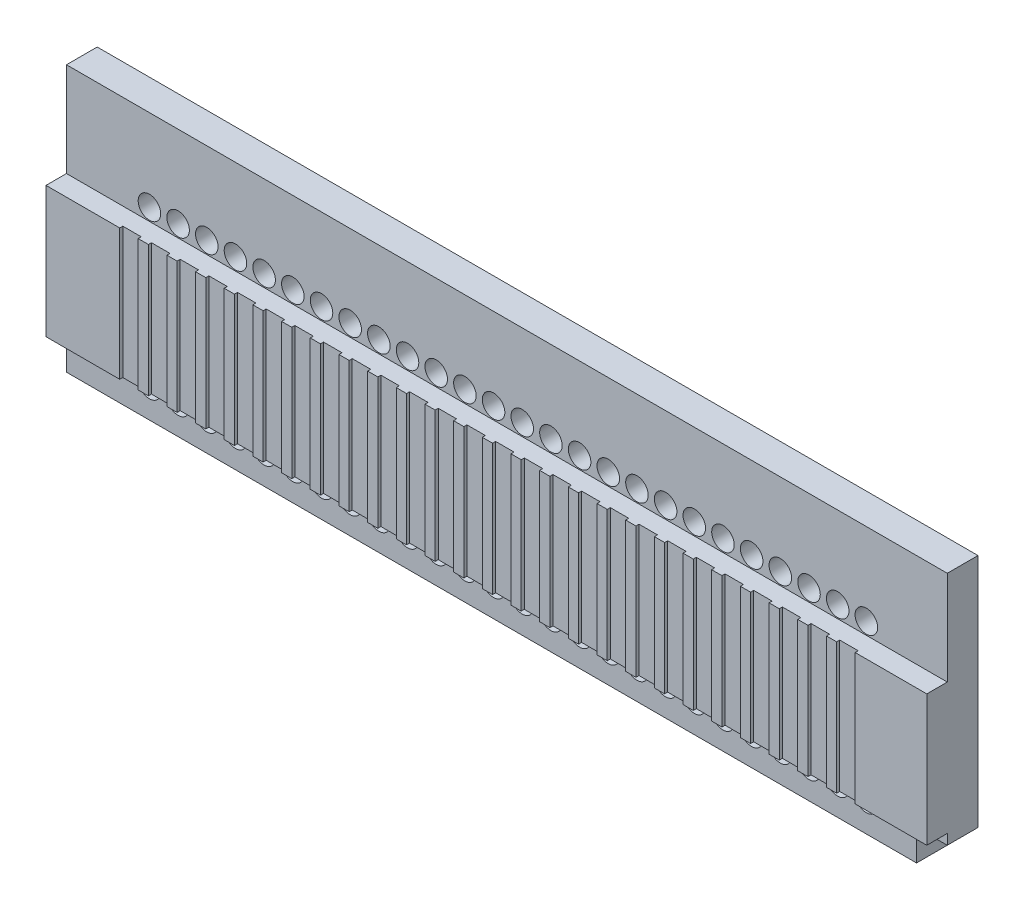
from build123d import *

# Parameters (mm, degrees)
ESQUISSE1_W                = 43
ESQUISSE1_H                = 13
BOSS_EXTRU_1_DEPTH         = 1.5
ESQUISSE2_W                = 1
ESQUISSE2_H                = 6.4
BOSS_EXTRU_2_DEPTH         = 1
ESQUISSE3_W                = 1
ESQUISSE3_H                = 6.4
BOSS_EXTRU_3_DEPTH         = 42
ESQUISSE8_W                = 1.5
ESQUISSE8_H                = 1.5
ENL_V_MAT_EXTRU_5_DEPTH    = 4.5
ESQUISSE9_W                = 0.9
ESQUISSE9_H                = 6.4
ENL_V_MAT_EXTRU_6_DEPTH    = 0.15
R_P_TITION_LIN_AIRE4_COUNT = 26
R_P_TITION_LIN_AIRE4_PITCH = 1.4
ESQUISSE10_R               = 0.55
ENL_V_MAT_EXTRU_8_DEPTH    = 45.947191236
R_P_TITION_LIN_AIRE5_COUNT = 26
R_P_TITION_LIN_AIRE5_PITCH = 1.4
ESQUISSE11_R               = 0.55
ENL_V_MAT_EXTRU_9_DEPTH    = 7.3
R_P_TITION_LIN_AIRE6_COUNT = 26
R_P_TITION_LIN_AIRE6_PITCH = 1.4


with BuildPart() as part:
    # Esquisse1 → Boss.-Extru.1 (new body)
    with BuildSketch(Plane.XY):
        with Locations((21.5, 6.5)):
            Rectangle(ESQUISSE1_W, ESQUISSE1_H)
    extrude(amount=BOSS_EXTRU_1_DEPTH)

    # Esquisse2 → Boss.-Extru.2 (add)
    with BuildSketch(Plane.XY.offset(1.5)):
        with Locations((42.5, 5.2)):
            Rectangle(ESQUISSE2_W, ESQUISSE2_H)
    extrude(amount=BOSS_EXTRU_2_DEPTH)

    # Esquisse3 → Boss.-Extru.3 (add)
    with BuildSketch(Plane.ZY.offset(-42)):
        with Locations((2, 5.2)):
            Rectangle(ESQUISSE3_W, ESQUISSE3_H)
    extrude(amount=BOSS_EXTRU_3_DEPTH)

    # Esquisse8 → Enlèv. mat.-Extru.5 (cut)
    with BuildSketch(Plane(origin=(0, 0, 0), x_dir=(-1, 0, 0), z_dir=(0, 0, -1))):
        with Locations((-42.25, 0.75)):
            Rectangle(ESQUISSE8_W, ESQUISSE8_H)
    extrude(amount=-ENL_V_MAT_EXTRU_5_DEPTH, mode=Mode.SUBTRACT)

    # Esquisse9 → Enlèv. mat.-Extru.6 (cut)
    with BuildSketch(Plane.XY.offset(2.5)):
        with Locations((39.05, 5.2)):
            Rectangle(ESQUISSE9_W, ESQUISSE9_H)
    enl_v_mat_extru_6 = extrude(amount=-ENL_V_MAT_EXTRU_6_DEPTH, mode=Mode.SUBTRACT)

    # Répétition linéaire4: Enlèv. mat.-Extru.6 ×26
    with Locations(*[(-i * R_P_TITION_LIN_AIRE4_PITCH, 0, 0) for i in range(1, R_P_TITION_LIN_AIRE4_COUNT)]):
        add(enl_v_mat_extru_6, mode=Mode.SUBTRACT)

    # Esquisse10 → Enlèv. mat.-Extru.8 (cut, through all)
    with BuildSketch(Plane.XY.offset(1.5)):
        with Locations((39.05, 9)):
            Circle(ESQUISSE10_R)
    enl_v_mat_extru_8 = extrude(amount=-ENL_V_MAT_EXTRU_8_DEPTH, mode=Mode.SUBTRACT)

    # Répétition linéaire5: Enlèv. mat.-Extru.8 ×26
    with Locations(*[(-i * R_P_TITION_LIN_AIRE5_PITCH, 0, 0) for i in range(1, R_P_TITION_LIN_AIRE5_COUNT)]):
        add(enl_v_mat_extru_8, mode=Mode.SUBTRACT)

    # Esquisse11 → Enlèv. mat.-Extru.9 (cut)
    with BuildSketch(Plane.XY.offset(1.5)):
        with Locations(Location((39.05, 1.45, 0), (0, 0, 90))):
            Circle(ESQUISSE11_R)
    enl_v_mat_extru_9 = extrude(amount=-ENL_V_MAT_EXTRU_9_DEPTH, mode=Mode.SUBTRACT)

    # Répétition linéaire6: Enlèv. mat.-Extru.9 ×26
    with Locations(*[(-i * R_P_TITION_LIN_AIRE6_PITCH, 0, 0) for i in range(1, R_P_TITION_LIN_AIRE6_COUNT)]):
        add(enl_v_mat_extru_9, mode=Mode.SUBTRACT)


solid = part.part
